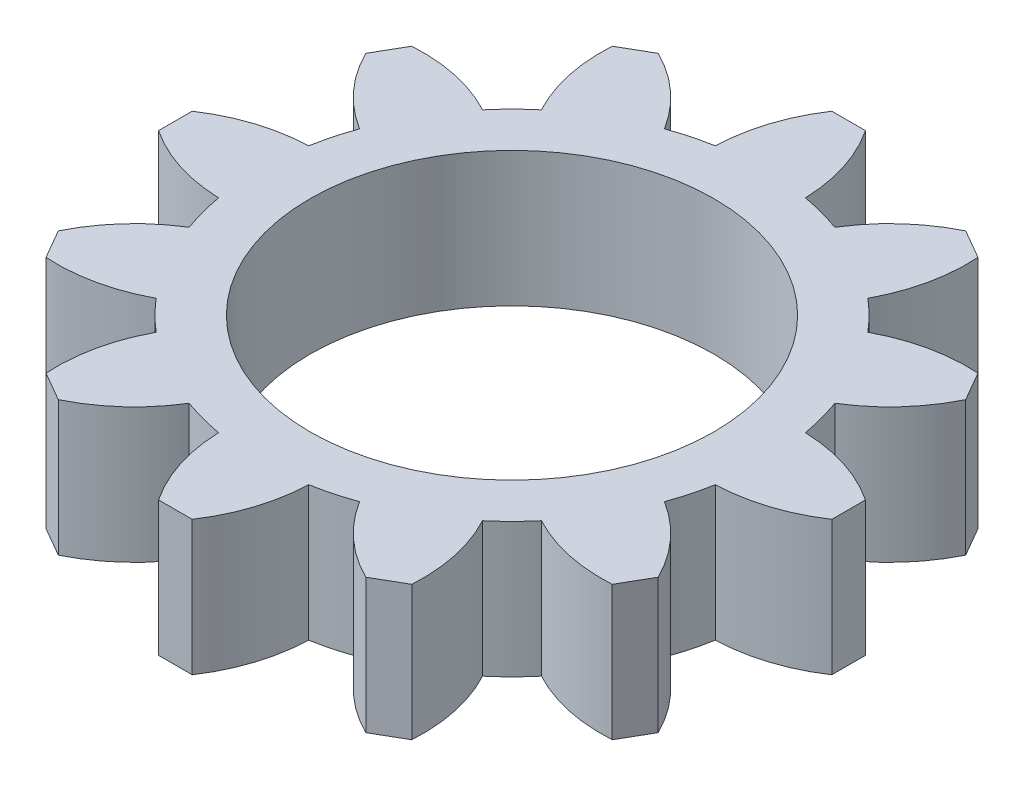
from build123d import *

# Parameters (mm, degrees)
SKETCH1_R           = 12
BOSS_EXTRUDE1_DEPTH = 8


with BuildPart() as part:
    # Sketch1 → Boss-Extrude1 (new body)
    with BuildSketch(Plane(origin=(0, 0, 0), x_dir=(1, 0, 0), z_dir=(0, 1, 0))):
        with BuildLine():
            Line((-1, 20), (1, 20))
            ThreePointArc((1, 20), (2.204975942, 17.497232023), (2.675, 14.759551992))
            ThreePointArc((2.675, 14.759551992), (3.882285677, 14.488887394), (5.063158041, 14.119646973))
            ThreePointArc((5.063158041, 14.119646973), (6.839050831, 16.255535399), (9.133974596, 17.820508076))
            Line((9.133974596, 17.820508076), (10.866025404, 16.820508076))
            ThreePointArc((10.866025404, 16.820508076), (10.658181192, 14.050559457), (9.696393951, 11.444646973))
            ThreePointArc((9.696393951, 11.444646973), (10.606601718, 10.606601718), (11.444646973, 9.696393951))
            ThreePointArc((11.444646973, 9.696393951), (14.050559457, 10.658181192), (16.820508076, 10.866025404))
            Line((16.820508076, 10.866025404), (17.820508076, 9.133974596))
            ThreePointArc((17.820508076, 9.133974596), (16.255535399, 6.839050831), (14.119646973, 5.063158041))
            ThreePointArc((14.119646973, 5.063158041), (14.488887394, 3.882285677), (14.759551992, 2.675))
            ThreePointArc((14.759551992, 2.675), (17.497232023, 2.204975942), (20, 1))
            Line((20, 1), (20, -1))
            ThreePointArc((20, -1), (17.497232023, -2.204975942), (14.759551992, -2.675))
            ThreePointArc((14.759551992, -2.675), (14.488887394, -3.882285677), (14.119646973, -5.063158041))
            ThreePointArc((14.119646973, -5.063158041), (16.255535399, -6.839050831), (17.820508076, -9.133974596))
            Line((17.820508076, -9.133974596), (16.820508076, -10.866025404))
            ThreePointArc((16.820508076, -10.866025404), (14.050559457, -10.658181192), (11.444646973, -9.696393951))
            ThreePointArc((11.444646973, -9.696393951), (10.606601718, -10.606601718), (9.696393951, -11.444646973))
            ThreePointArc((9.696393951, -11.444646973), (10.658181192, -14.050559457), (10.866025404, -16.820508076))
            Line((10.866025404, -16.820508076), (9.133974596, -17.820508076))
            ThreePointArc((9.133974596, -17.820508076), (6.839050831, -16.255535399), (5.063158041, -14.119646973))
            ThreePointArc((5.063158041, -14.119646973), (3.882285677, -14.488887394), (2.675, -14.759551992))
            ThreePointArc((2.675, -14.759551992), (2.204975942, -17.497232023), (1, -20))
            Line((1, -20), (-1, -20))
            ThreePointArc((-1, -20), (-2.204975942, -17.497232023), (-2.675, -14.759551992))
            ThreePointArc((-2.675, -14.759551992), (-3.882285677, -14.488887394), (-5.063158041, -14.119646973))
            ThreePointArc((-5.063158041, -14.119646973), (-6.839050831, -16.255535399), (-9.133974596, -17.820508076))
            Line((-9.133974596, -17.820508076), (-10.866025404, -16.820508076))
            ThreePointArc((-10.866025404, -16.820508076), (-10.658181192, -14.050559457), (-9.696393951, -11.444646973))
            ThreePointArc((-9.696393951, -11.444646973), (-10.606601718, -10.606601718), (-11.444646973, -9.696393951))
            ThreePointArc((-11.444646973, -9.696393951), (-14.050559457, -10.658181192), (-16.820508076, -10.866025404))
            Line((-16.820508076, -10.866025404), (-17.820508076, -9.133974596))
            ThreePointArc((-17.820508076, -9.133974596), (-16.255535399, -6.839050831), (-14.119646973, -5.063158041))
            ThreePointArc((-14.119646973, -5.063158041), (-14.488887394, -3.882285677), (-14.759551992, -2.675))
            ThreePointArc((-14.759551992, -2.675), (-17.497232023, -2.204975942), (-20, -1))
            Line((-20, -1), (-20, 1))
            ThreePointArc((-20, 1), (-17.497232023, 2.204975942), (-14.759551992, 2.675))
            ThreePointArc((-14.759551992, 2.675), (-14.488887394, 3.882285677), (-14.119646973, 5.063158041))
            ThreePointArc((-14.119646973, 5.063158041), (-16.255535399, 6.839050831), (-17.820508076, 9.133974596))
            Line((-17.820508076, 9.133974596), (-16.820508076, 10.866025404))
            ThreePointArc((-16.820508076, 10.866025404), (-14.050559457, 10.658181192), (-11.444646973, 9.696393951))
            ThreePointArc((-11.444646973, 9.696393951), (-10.606601718, 10.606601718), (-9.696393951, 11.444646973))
            ThreePointArc((-9.696393951, 11.444646973), (-10.658181192, 14.050559457), (-10.866025404, 16.820508076))
            Line((-10.866025404, 16.820508076), (-9.133974596, 17.820508076))
            ThreePointArc((-9.133974596, 17.820508076), (-6.839050831, 16.255535399), (-5.063158041, 14.119646973))
            ThreePointArc((-5.063158041, 14.119646973), (-3.882285677, 14.488887394), (-2.675, 14.759551992))
            ThreePointArc((-2.675, 14.759551992), (-2.204975942, 17.497232023), (-1, 20))
        make_face()
        with Locations(Location((0, 0, 0), (0, 0, 270))):
            Circle(SKETCH1_R, mode=Mode.SUBTRACT)
    extrude(amount=BOSS_EXTRUDE1_DEPTH)


solid = part.part
